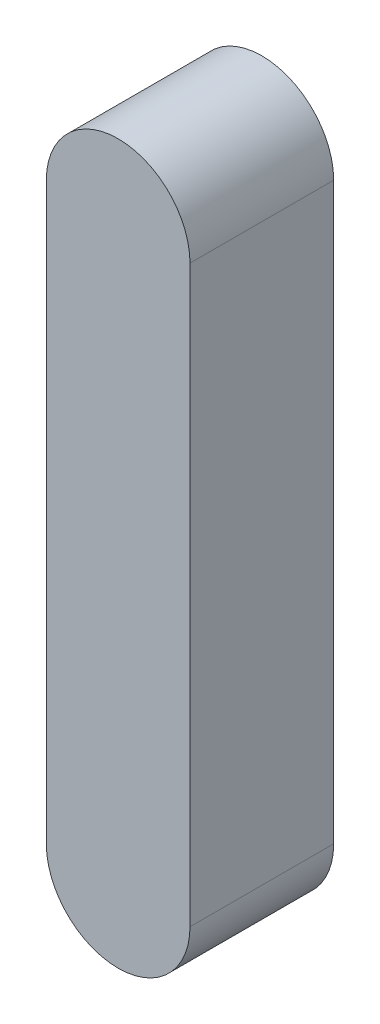
from build123d import *

# Parameters (mm, degrees)
EXTRUDE_1_DEPTH = 2


with BuildPart() as part:
    # 草图1 → 凸台-拉伸1 (new body)
    with BuildSketch(Plane.XY):
        with BuildLine():
            Line((-1, 4), (-1, -4))
            ThreePointArc((-1, -4), (0, -5), (1, -4))
            Line((1, -4), (1, 4))
            ThreePointArc((1, 4), (0, 5), (-1, 4))
        make_face()
    extrude(amount=EXTRUDE_1_DEPTH)


solid = part.part
